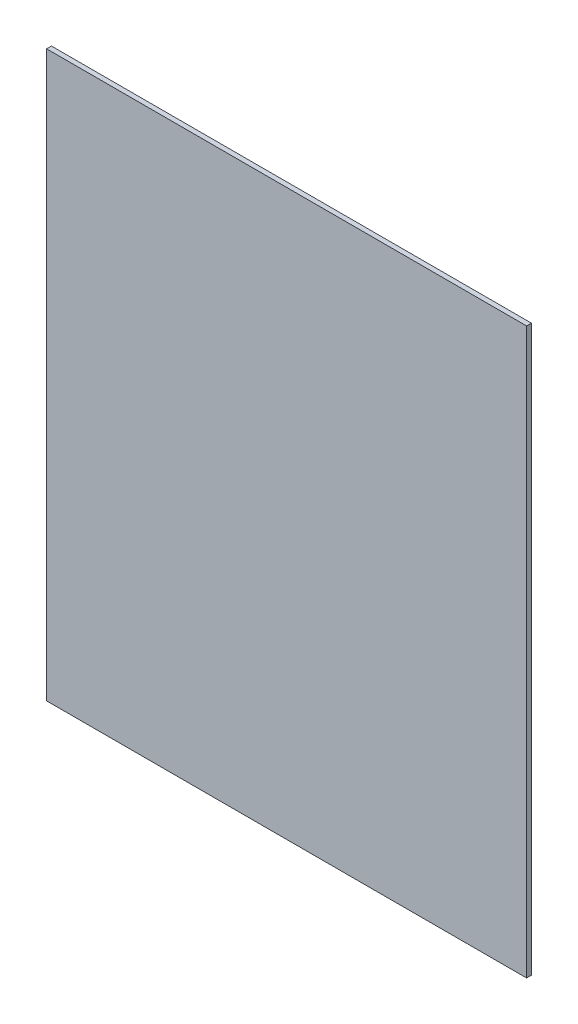
from build123d import *

# Parameters (mm, degrees)
SKETCH1_W           = 59.5
SKETCH1_H           = 70
BOSS_EXTRUDE1_DEPTH = 0.6
BOSS_EXTRUDE2_DEPTH = 0.4
BOSS_EXTRUDE3_DEPTH = 0.4


with BuildPart() as part:
    # Sketch1 → Boss-Extrude1 (new body)
    with BuildSketch(Plane.XY):
        with Locations((29.75, -35)):
            Rectangle(SKETCH1_W, SKETCH1_H)
    extrude(amount=BOSS_EXTRUDE1_DEPTH)

    # Sketch2 → Boss-Extrude2 (add)
    with BuildSketch(Plane(origin=(0, 0, 0), x_dir=(-1, 0, 0), z_dir=(0, 0, -1))):
        with BuildLine():
            add(Edge.make_bspline(
                [(-29.360295117, -22.906491144), (-27.452190625, -19.067742152), (-12.945888269, -12.870561604), (-9.299474882, -33.439990883), (-29.360295117, -42.258664162)],
                knots=[0, 0, 0, 0, 0.41260984, 1, 1, 1, 1], degree=3))
            add(Edge.make_bspline(
                [(-29.360295117, -22.906491144), (-31.268399608, -19.067742152), (-45.774701965, -12.870561604), (-49.421115352, -33.439990883), (-29.360295117, -42.258664162)],
                knots=[0, 0, 0, 0, 0.41260984, 1, 1, 1, 1], degree=3))
        make_face()
    extrude(amount=BOSS_EXTRUDE2_DEPTH)

    # Sketch3 → Boss-Extrude3 (add)
    # profile 1 of 4: a face of its own
    with BuildSketch(Plane(origin=(0, 0, 0), x_dir=(-1, 0, 0), z_dir=(0, 0, -1))):
        with BuildLine():
            Line((-38.953376642, -45.860486307), (-36.880920446, -45.860486307))
            add(Edge.make_bspline(
                [(-36.880920446, -45.860486307), (-36.824318303, -45.860456963), (-36.714100782, -45.860399825), (-36.554146303, -45.867035613), (-36.404568301, -45.873710343), (-36.265796102, -45.887071691), (-36.137348262, -45.901076754), (-36.018994286, -45.918808218), (-35.911481823, -45.941533029), (-35.843684524, -45.959454261), (-35.811302148, -45.968014072)],
                knots=[0, 0, 0, 0, 1.259756885, 2.453039283, 3.563158368, 4.591894114, 5.55549294, 6.43918076, 7.254497783, 8, 8, 8, 8], degree=3))
            add(Edge.make_bspline(
                [(-35.811302148, -45.968014072), (-35.770806008, -45.981212396), (-35.690543158, -46.007371311), (-35.572875351, -46.053206086), (-35.461391231, -46.11005045), (-35.35195487, -46.169804452), (-35.249451818, -46.240456608), (-35.148457414, -46.31396072), (-35.055526032, -46.399107544), (-34.933658476, -46.518105837), (-34.794598331, -46.683874224), (-34.648911639, -46.903757658), (-34.525602353, -47.145109979), (-34.44135178, -47.361353254), (-34.384462522, -47.545178305), (-34.347274634, -47.692559384), (-34.315685786, -47.847806554), (-34.289751244, -48.010958952), (-34.269600851, -48.1820166), (-34.25459867, -48.360933906), (-34.247291094, -48.547865429), (-34.245636539, -48.675068029), (-34.244792386, -48.739966678)],
                knots=[0, 0, 0, 0, 0.745524535, 1.477620414, 2.207090574, 2.934465325, 3.657932502, 4.384347339, 5.118673636, 5.861150177, 7.365375624, 8.894729774, 10.468936425, 12.099947606, 12.950091786, 13.83580991, 14.759228729, 15.722225242, 16.726454549, 17.773376212, 18.863978586, 20, 20, 20, 20], degree=3))
            add(Edge.make_bspline(
                [(-34.244792386, -48.739966678), (-34.246333352, -48.852131464), (-34.24931355, -49.069055909), (-34.283839328, -49.382076976), (-34.333595336, -49.672816746), (-34.389680678, -49.854192856), (-34.416836811, -49.942013909)],
                knots=[0, 0, 0, 0, 1.103207939, 2.133582005, 3.096293362, 4, 4, 4, 4], degree=3))
            add(Edge.make_bspline(
                [(-34.416836811, -49.942013909), (-34.434768856, -49.992407544), (-34.470043988, -50.091539685), (-34.531772823, -50.234538286), (-34.598471266, -50.370622604), (-34.670692553, -50.499685422), (-34.748801566, -50.621146213), (-34.833090462, -50.734641679), (-34.922252696, -50.841666023), (-34.986845576, -50.907540014), (-35.018992297, -50.940324321)],
                knots=[0, 0, 0, 0, 1.090884612, 2.145940218, 3.175104604, 4.181306866, 5.161203701, 6.118658341, 7.063689906, 8, 8, 8, 8], degree=3))
            add(Edge.make_bspline(
                [(-35.018992297, -50.940324321), (-35.071013459, -50.98710736), (-35.178288509, -51.083580656), (-35.36732552, -51.202970216), (-35.580990499, -51.308466113), (-35.73554268, -51.362657604), (-35.815829633, -51.390809064)],
                knots=[0, 0, 0, 0, 0.908140292, 1.872714733, 2.8949153, 4, 4, 4, 4], degree=3))
            add(Edge.make_bspline(
                [(-35.815829633, -51.390809064), (-35.848149206, -51.400735368), (-35.915226807, -51.421336897), (-36.021584959, -51.443339756), (-36.135124954, -51.466519986), (-36.257156065, -51.480484114), (-36.386411552, -51.495209904), (-36.523921461, -51.503477613), (-36.669209118, -51.509347206), (-36.76885836, -51.510300226), (-36.819799401, -51.510787413)],
                knots=[0, 0, 0, 0, 0.799129865, 1.658552685, 2.566799617, 3.538529252, 4.561352959, 5.643373779, 6.795284424, 8, 8, 8, 8], degree=3))
            Line((-36.819799401, -51.510787413), (-38.953376642, -51.510787413))
            Line((-38.953376642, -51.510787413), (-38.953376642, -45.860486307))
        make_face()
        with BuildLine():
            Line((-37.866780275, -46.802203158), (-37.866780275, -50.569070562))
            Line((-37.866780275, -50.569070562), (-36.972602015, -50.569070562))
            add(Edge.make_bspline(
                [(-36.972602015, -50.569070562), (-36.932232211, -50.568750402), (-36.854504915, -50.568133971), (-36.742031529, -50.566322665), (-36.638669433, -50.561419115), (-36.543877153, -50.556339836), (-36.457901471, -50.547947979), (-36.380368293, -50.539694268), (-36.311709206, -50.528147499), (-36.269303666, -50.519032632), (-36.249336308, -50.514740744)],
                knots=[0, 0, 0, 0, 1.333384787, 2.567275092, 3.714769766, 4.750907381, 5.701951617, 6.567520054, 7.325492842, 8, 8, 8, 8], degree=3))
            add(Edge.make_bspline(
                [(-36.249336308, -50.514740744), (-36.202570492, -50.502261304), (-36.111483018, -50.477954647), (-35.983586996, -50.423768114), (-35.867857574, -50.358397989), (-35.762356637, -50.279793225), (-35.667278454, -50.180454984), (-35.586117603, -50.053409162), (-35.511005374, -49.901889097), (-35.459568502, -49.756846501), (-35.422647214, -49.627297847), (-35.397654531, -49.518564465), (-35.377903489, -49.40092594), (-35.360915018, -49.274846549), (-35.347187928, -49.140488425), (-35.338646284, -48.997366378), (-35.332816559, -48.845655603), (-35.331873704, -48.741481765), (-35.331388753, -48.687900602)],
                knots=[0, 0, 0, 0, 1.038686998, 2.023088296, 2.974059649, 3.888265163, 4.839857954, 5.909819677, 7.113156087, 8.466843969, 9.20827164, 10.006482943, 10.861893492, 11.769681931, 12.739021491, 13.762258324, 14.849031541, 16, 16, 16, 16], degree=3))
            add(Edge.make_bspline(
                [(-35.331388753, -48.687900602), (-35.331869975, -48.634319275), (-35.332802192, -48.530522148), (-35.338622976, -48.3799426), (-35.347116641, -48.239074327), (-35.36094149, -48.107743192), (-35.377666613, -47.985767689), (-35.397649004, -47.873044596), (-35.422491028, -47.770313681), (-35.45944372, -47.648267457), (-35.515462098, -47.511083711), (-35.591692178, -47.361094421), (-35.68530534, -47.233254325), (-35.788738769, -47.122197544), (-35.907999259, -47.030803426), (-36.040020334, -46.954255528), (-36.187676469, -46.894842057), (-36.292708917, -46.869535911), (-36.346677233, -46.856532976)],
                knots=[0, 0, 0, 0, 1.117996097, 2.165769068, 3.143980016, 4.062055362, 4.920439205, 5.712587309, 6.449616741, 7.124491204, 8.371470382, 9.537068822, 10.625202851, 11.666538334, 12.693249444, 13.747832046, 14.842779399, 16, 16, 16, 16], degree=3))
            add(Edge.make_bspline(
                [(-36.346677233, -46.856532976), (-36.370037349, -46.852192339), (-36.421467384, -46.842635919), (-36.506810577, -46.831473964), (-36.606937159, -46.82319084), (-36.722357556, -46.814734498), (-36.85260442, -46.809907884), (-36.998222735, -46.804870528), (-37.158603158, -46.803149777), (-37.270661837, -46.802527765), (-37.329141448, -46.802203158)],
                knots=[0, 0, 0, 0, 0.578738571, 1.274160813, 2.095454135, 3.025967819, 4.093109015, 5.270126069, 6.575371698, 8, 8, 8, 8], degree=3))
            Line((-37.329141448, -46.802203158), (-37.866780275, -46.802203158))
        make_face(mode=Mode.SUBTRACT)
    # profile 2 of 4: a face of its own
    with BuildSketch(Plane(origin=(0, 0, 0), x_dir=(-1, 0, 0), z_dir=(0, 0, -1))):
        Polygon((-33.303075535, -51.510787413), (-33.303075535, -45.860486307), (-32.216479168, -45.860486307), (-32.216479168, -50.569070562), (-29.318888857, -50.569070562), (-29.318888857, -51.510787413), align=None)
    # profile 3 of 4: a face of its own
    with BuildSketch(Plane(origin=(0, 0, 0), x_dir=(-1, 0, 0), z_dir=(0, 0, -1))):
        with BuildLine():
            Line((-28.522051521, -51.510787413), (-28.522051521, -45.860486307))
            Line((-28.522051521, -45.860486307), (-26.150781325, -45.860486307))
            add(Edge.make_bspline(
                [(-26.150781325, -45.860486307), (-26.07871608, -45.860930443), (-25.939833164, -45.861786375), (-25.738981371, -45.868028004), (-25.553750933, -45.881104581), (-25.383320165, -45.895913911), (-25.228507659, -45.917460532), (-25.088701315, -45.943273171), (-24.964136505, -45.973186462), (-24.852995756, -46.009012478), (-24.751657971, -46.050016598), (-24.657256852, -46.098823038), (-24.568754432, -46.156005781), (-24.484791398, -46.219593894), (-24.405012204, -46.289685084), (-24.331603969, -46.36813431), (-24.263287729, -46.453773438), (-24.200118604, -46.545889945), (-24.14447056, -46.64407708), (-24.093622857, -46.745181543), (-24.052230909, -46.850279236), (-24.018041537, -46.958875072), (-23.990730538, -47.070733273), (-23.971774398, -47.186138225), (-23.959940284, -47.30488104), (-23.958883851, -47.385088369), (-23.958346781, -47.425864197)],
                knots=[0, 0, 0, 0, 1.675828044, 3.229627355, 4.67171229, 5.993455049, 7.206927059, 8.304770529, 9.29850117, 10.183580433, 11.017754134, 11.837875825, 12.650738409, 13.464925643, 14.285328857, 15.117007378, 15.959673368, 16.830859064, 17.711229498, 18.58228265, 19.460420693, 20.334473227, 21.228207035, 22.135446768, 23.052097822, 24, 24, 24, 24], degree=3))
            add(Edge.make_bspline(
                [(-23.958346781, -47.425864197), (-23.959342965, -47.477230328), (-23.961289783, -47.577613905), (-23.979205428, -47.72474499), (-24.005814737, -47.865318238), (-24.043746101, -47.999528402), (-24.095900955, -48.125796979), (-24.156446365, -48.245892812), (-24.228656938, -48.359408533), (-24.312042081, -48.465218808), (-24.406527144, -48.5634173), (-24.512526196, -48.651983159), (-24.629282437, -48.731262523), (-24.757502172, -48.800798218), (-24.896292599, -48.860243702), (-25.04625556, -48.910259321), (-25.206712171, -48.950966462), (-25.318325701, -48.97012039), (-25.375449543, -48.979923376)],
                knots=[0, 0, 0, 0, 1.05911256, 2.069797862, 3.05271628, 4.008392045, 4.940519534, 5.866323021, 6.779546087, 7.71056835, 8.640711998, 9.585328432, 10.554502533, 11.547017206, 12.589327225, 13.664782803, 14.804835066, 16, 16, 16, 16], degree=3))
            add(Edge.make_bspline(
                [(-25.375449543, -48.979923376), (-25.320204373, -49.016512772), (-25.212082048, -49.088123204), (-25.062487029, -49.206066484), (-24.928186196, -49.329857078), (-24.82650038, -49.439939375), (-24.74836531, -49.53674493), (-24.685453229, -49.621412001), (-24.617592464, -49.718851519), (-24.545448581, -49.829116279), (-24.466888825, -49.951230698), (-24.384834973, -50.087063927), (-24.297569932, -50.235291027), (-24.238898024, -50.338835161), (-24.20849032, -50.392498653)],
                knots=[0, 0, 0, 0, 1.285445069, 2.515791127, 3.691898215, 4.826622834, 5.420063933, 6.105349801, 6.873086501, 7.723915395, 8.66222816, 9.690593598, 10.803111229, 12, 12, 12, 12], degree=3))
            Line((-24.20849032, -50.392498653), (-23.523708235, -51.510787413))
            Line((-23.523708235, -51.510787413), (-24.793667738, -51.510787413))
            Line((-24.793667738, -51.510787413), (-25.597296301, -50.228377326))
            add(Edge.make_bspline(
                [(-25.597296301, -50.228377326), (-25.634203716, -50.177017728), (-25.704667557, -50.078961696), (-25.806386467, -49.939620891), (-25.899450241, -49.815582549), (-25.981382143, -49.705050044), (-26.056327892, -49.611157234), (-26.122011837, -49.532267893), (-26.17709608, -49.466689169), (-26.239424039, -49.401665033), (-26.311936002, -49.334838334), (-26.40170002, -49.270046046), (-26.493879338, -49.218394317), (-26.592642114, -49.178982834), (-26.706858281, -49.151502529), (-26.844164201, -49.133994082), (-27.008877094, -49.121076547), (-27.127931517, -49.120555991), (-27.192102843, -49.120275407)],
                knots=[0, 0, 0, 0, 1.465447777, 2.797841088, 3.997266218, 5.05856206, 5.985598736, 6.780315439, 7.437430484, 7.969193402, 8.866571936, 9.718200644, 10.52825214, 11.309096006, 12.174169268, 13.242355782, 14.513606761, 16, 16, 16, 16], degree=3))
            Line((-27.192102843, -49.120275407), (-27.435455155, -49.120275407))
            Line((-27.435455155, -49.120275407), (-27.435455155, -51.510787413))
            Line((-27.435455155, -51.510787413), (-28.522051521, -51.510787413))
        make_face()
        with BuildLine():
            Line((-27.435455155, -48.178558555), (-26.560518705, -48.178558555))
            add(Edge.make_bspline(
                [(-26.560518705, -48.178558555), (-26.492980462, -48.178413817), (-26.364308696, -48.178138065), (-26.181334885, -48.174143917), (-26.01787766, -48.170753853), (-25.87491519, -48.162236171), (-25.751807848, -48.153794346), (-25.649049482, -48.142823036), (-25.565774323, -48.129855301), (-25.482596435, -48.109693879), (-25.397394017, -48.074566582), (-25.30658436, -48.024534969), (-25.228971593, -47.9596304), (-25.16174101, -47.884594155), (-25.110453495, -47.796382224), (-25.070283239, -47.698924549), (-25.049916069, -47.590055533), (-25.046635521, -47.514595128), (-25.044943148, -47.475666531)],
                knots=[0, 0, 0, 0, 1.697953026, 3.23488743, 4.60134403, 5.807846676, 6.835100678, 7.703488618, 8.405232423, 8.952775585, 9.851109663, 10.713519226, 11.549115941, 12.382556273, 13.233359028, 14.101746968, 15.020727134, 16, 16, 16, 16], degree=3))
            add(Edge.make_bspline(
                [(-25.044943148, -47.475666531), (-25.046867904, -47.432116847), (-25.05058141, -47.348094753), (-25.079866648, -47.228530513), (-25.130982837, -47.122911969), (-25.201184766, -47.031064741), (-25.289312229, -46.953507618), (-25.394281782, -46.891944143), (-25.515313577, -46.846094221), (-25.602609523, -46.829161934), (-25.648230506, -46.820313097)],
                knots=[0, 0, 0, 0, 1.062977961, 2.050844577, 2.982300261, 3.90936959, 4.856017476, 5.831122378, 6.86654153, 8, 8, 8, 8], degree=3))
            add(Edge.make_bspline(
                [(-25.648230506, -46.820313097), (-25.663310568, -46.818656122), (-25.699053482, -46.814728744), (-25.76217123, -46.812206362), (-25.842875368, -46.808329185), (-25.94214274, -46.80674467), (-26.059086497, -46.803967153), (-26.194171658, -46.803457131), (-26.346969047, -46.801827647), (-26.454876738, -46.802073406), (-26.511848243, -46.802203158)],
                knots=[0, 0, 0, 0, 0.42127143, 0.998501726, 1.753681744, 2.66564073, 3.755712164, 5.002818897, 6.417592707, 8, 8, 8, 8], degree=3))
            Line((-26.511848243, -46.802203158), (-27.435455155, -46.802203158))
            Line((-27.435455155, -46.802203158), (-27.435455155, -48.178558555))
        make_face(mode=Mode.SUBTRACT)
    # profile 4 of 4: a face of its own
    with BuildSketch(Plane(origin=(0, 0, 0), x_dir=(-1, 0, 0), z_dir=(0, 0, -1))):
        with BuildLine():
            Line((-22.871750415, -51.510787413), (-22.871750415, -45.860486307))
            Line((-22.871750415, -45.860486307), (-20.500480219, -45.860486307))
            add(Edge.make_bspline(
                [(-20.500480219, -45.860486307), (-20.428414974, -45.860930443), (-20.289532057, -45.861786375), (-20.088680264, -45.868028004), (-19.903449826, -45.881104581), (-19.733019058, -45.895913911), (-19.578206552, -45.917460532), (-19.438400208, -45.943273171), (-19.313835398, -45.973186462), (-19.20269465, -46.009012478), (-19.101356864, -46.050016598), (-19.006955745, -46.098823038), (-18.918453325, -46.156005781), (-18.834490292, -46.219593894), (-18.754711097, -46.289685084), (-18.681302862, -46.36813431), (-18.612986622, -46.453773438), (-18.549817497, -46.545889945), (-18.494169453, -46.64407708), (-18.44332175, -46.745181543), (-18.401929803, -46.850279236), (-18.36774043, -46.958875072), (-18.340429432, -47.070733273), (-18.321473291, -47.186138225), (-18.309639177, -47.30488104), (-18.308582744, -47.385088369), (-18.308045675, -47.425864197)],
                knots=[0, 0, 0, 0, 1.675828044, 3.229627355, 4.67171229, 5.993455049, 7.206927059, 8.304770529, 9.29850117, 10.183580433, 11.017754134, 11.837875825, 12.650738409, 13.464925643, 14.285328857, 15.117007378, 15.959673368, 16.830859064, 17.711229498, 18.58228265, 19.460420693, 20.334473227, 21.228207035, 22.135446768, 23.052097822, 24, 24, 24, 24], degree=3))
            add(Edge.make_bspline(
                [(-18.308045675, -47.425864197), (-18.309041858, -47.477230328), (-18.310988676, -47.577613905), (-18.328904321, -47.72474499), (-18.35551363, -47.865318238), (-18.393444994, -47.999528402), (-18.445599848, -48.125796979), (-18.506145258, -48.245892812), (-18.578355831, -48.359408533), (-18.661740975, -48.465218808), (-18.756226037, -48.5634173), (-18.862225089, -48.651983159), (-18.97898133, -48.731262523), (-19.107201065, -48.800798218), (-19.245991493, -48.860243702), (-19.395954453, -48.910259321), (-19.556411064, -48.950966462), (-19.668024595, -48.97012039), (-19.725148436, -48.979923376)],
                knots=[0, 0, 0, 0, 1.05911256, 2.069797862, 3.05271628, 4.008392045, 4.940519534, 5.866323021, 6.779546087, 7.71056835, 8.640711998, 9.585328432, 10.554502533, 11.547017206, 12.589327225, 13.664782803, 14.804835066, 16, 16, 16, 16], degree=3))
            add(Edge.make_bspline(
                [(-19.725148436, -48.979923376), (-19.669903266, -49.016512772), (-19.561780942, -49.088123204), (-19.412185922, -49.206066484), (-19.27788509, -49.329857078), (-19.176199274, -49.439939375), (-19.098064204, -49.53674493), (-19.035152122, -49.621412001), (-18.967291357, -49.718851519), (-18.895147475, -49.829116279), (-18.816587718, -49.951230698), (-18.734533866, -50.087063927), (-18.647268825, -50.235291027), (-18.588596918, -50.338835161), (-18.558189213, -50.392498653)],
                knots=[0, 0, 0, 0, 1.285445069, 2.515791127, 3.691898215, 4.826622834, 5.420063933, 6.105349801, 6.873086501, 7.723915395, 8.66222816, 9.690593598, 10.803111229, 12, 12, 12, 12], degree=3))
            Line((-18.558189213, -50.392498653), (-17.873407128, -51.510787413))
            Line((-17.873407128, -51.510787413), (-19.143366631, -51.510787413))
            Line((-19.143366631, -51.510787413), (-19.946995194, -50.228377326))
            add(Edge.make_bspline(
                [(-19.946995194, -50.228377326), (-19.983902609, -50.177017728), (-20.054366451, -50.078961696), (-20.15608536, -49.939620891), (-20.249149134, -49.815582549), (-20.331081036, -49.705050044), (-20.406026785, -49.611157234), (-20.47171073, -49.532267893), (-20.526794974, -49.466689169), (-20.589122932, -49.401665033), (-20.661634895, -49.334838334), (-20.751398913, -49.270046046), (-20.843578231, -49.218394317), (-20.942341007, -49.178982834), (-21.056557174, -49.151502529), (-21.193863095, -49.133994082), (-21.358575987, -49.121076547), (-21.47763041, -49.120555991), (-21.541801737, -49.120275407)],
                knots=[0, 0, 0, 0, 1.465447777, 2.797841088, 3.997266218, 5.05856206, 5.985598736, 6.780315439, 7.437430484, 7.969193402, 8.866571936, 9.718200644, 10.52825214, 11.309096006, 12.174169268, 13.242355782, 14.513606761, 16, 16, 16, 16], degree=3))
            Line((-21.541801737, -49.120275407), (-21.785154048, -49.120275407))
            Line((-21.785154048, -49.120275407), (-21.785154048, -51.510787413))
            Line((-21.785154048, -51.510787413), (-22.871750415, -51.510787413))
        make_face()
        with BuildLine():
            Line((-21.785154048, -48.178558555), (-20.910217599, -48.178558555))
            add(Edge.make_bspline(
                [(-20.910217599, -48.178558555), (-20.842679355, -48.178413817), (-20.714007589, -48.178138065), (-20.531033778, -48.174143917), (-20.367576553, -48.170753853), (-20.224614083, -48.162236171), (-20.101506742, -48.153794346), (-19.998748376, -48.142823036), (-19.915473216, -48.129855301), (-19.832295329, -48.109693879), (-19.74709291, -48.074566582), (-19.656283253, -48.024534969), (-19.578670486, -47.9596304), (-19.511439904, -47.884594155), (-19.460152388, -47.796382224), (-19.419982132, -47.698924549), (-19.399614962, -47.590055533), (-19.396334414, -47.514595128), (-19.394642041, -47.475666531)],
                knots=[0, 0, 0, 0, 1.697953026, 3.23488743, 4.60134403, 5.807846676, 6.835100678, 7.703488618, 8.405232423, 8.952775585, 9.851109663, 10.713519226, 11.549115941, 12.382556273, 13.233359028, 14.101746968, 15.020727134, 16, 16, 16, 16], degree=3))
            add(Edge.make_bspline(
                [(-19.394642041, -47.475666531), (-19.396566797, -47.432116847), (-19.400280303, -47.348094753), (-19.429565541, -47.228530513), (-19.48068173, -47.122911969), (-19.550883659, -47.031064741), (-19.639011122, -46.953507618), (-19.743980675, -46.891944143), (-19.86501247, -46.846094221), (-19.952308416, -46.829161934), (-19.997929399, -46.820313097)],
                knots=[0, 0, 0, 0, 1.062977961, 2.050844577, 2.982300261, 3.90936959, 4.856017476, 5.831122378, 6.86654153, 8, 8, 8, 8], degree=3))
            add(Edge.make_bspline(
                [(-19.997929399, -46.820313097), (-20.013009461, -46.818656122), (-20.048752375, -46.814728744), (-20.111870123, -46.812206362), (-20.192574261, -46.808329185), (-20.291841634, -46.80674467), (-20.40878539, -46.803967153), (-20.543870551, -46.803457131), (-20.696667941, -46.801827647), (-20.804575632, -46.802073406), (-20.861547136, -46.802203158)],
                knots=[0, 0, 0, 0, 0.42127143, 0.998501726, 1.753681744, 2.66564073, 3.755712164, 5.002818897, 6.417592707, 8, 8, 8, 8], degree=3))
            Line((-20.861547136, -46.802203158), (-21.785154048, -46.802203158))
            Line((-21.785154048, -46.802203158), (-21.785154048, -48.178558555))
        make_face(mode=Mode.SUBTRACT)
    extrude(amount=BOSS_EXTRUDE3_DEPTH)


solid = part.part
